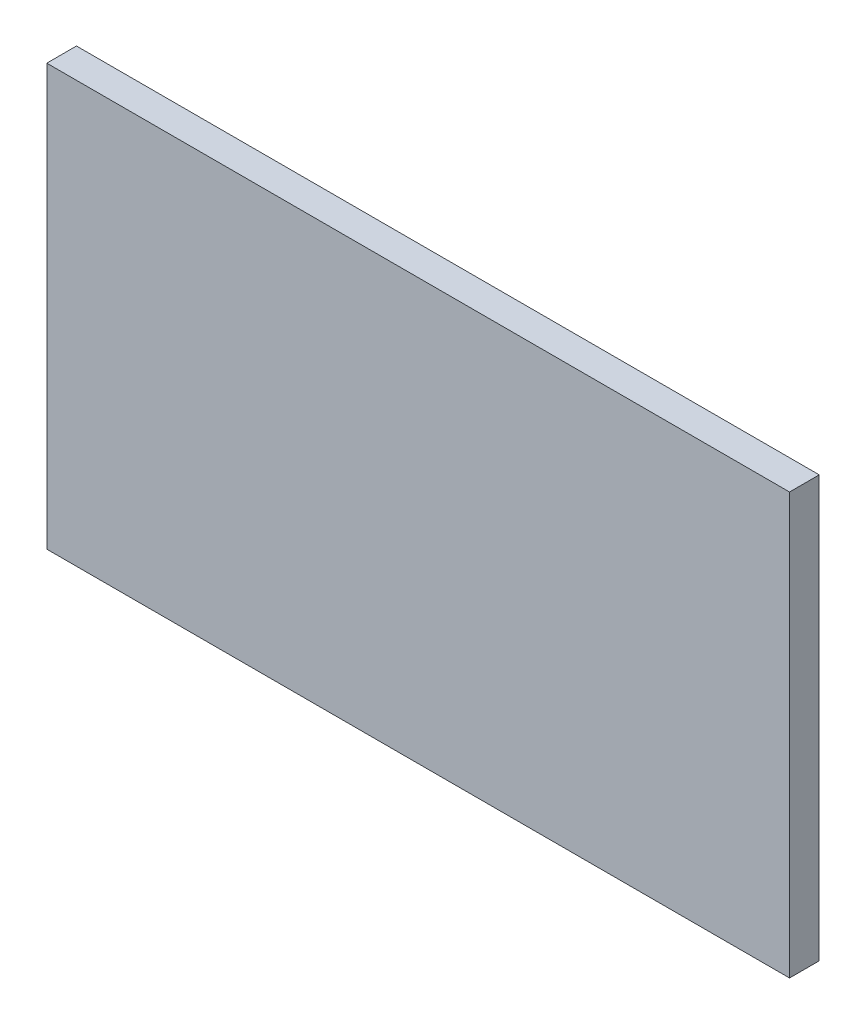
from build123d import *

# Parameters (mm, degrees)
SKETCH_1_W      = 1500
SKETCH_1_H      = 850
EXTRUDE_1_DEPTH = 60


with BuildPart() as part:
    # 草图1 → 凸台-拉伸1 (new body)
    with BuildSketch(Plane.XY):
        Rectangle(SKETCH_1_W, SKETCH_1_H)
    extrude(amount=EXTRUDE_1_DEPTH)


solid = part.part
